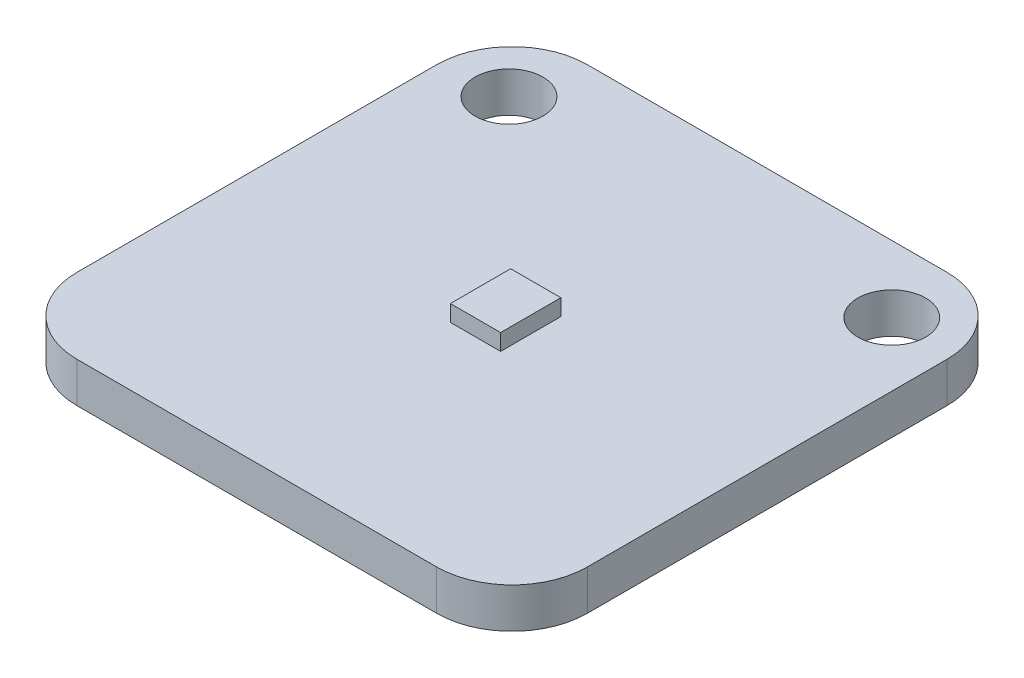
from build123d import *

# Parameters (mm, degrees)
FR4_DEPTH            = 1.6
SKETCH4_R            = 1.35
HOLES_MOUNTING_DEPTH = 15.45721965
SKETCH5_W            = 2
SKETCH5_H            = 2.4
TCS34725_DEPTH       = 0.65


with BuildPart() as part:
    # Sketch2 → FR4 (new body)
    with BuildSketch(Plane(origin=(0, 0, 0), x_dir=(1, 0, 0), z_dir=(0, 1, 0))):
        with BuildLine():
            Line((-7.16, 10.16), (7.16, 10.16))
            ThreePointArc((7.16, 10.16), (9.281320344, 9.281320344), (10.16, 7.16))
            Line((10.16, 7.16), (10.16, -7.16))
            ThreePointArc((10.16, -7.16), (9.281320344, -9.281320344), (7.16, -10.16))
            Line((7.16, -10.16), (-7.16, -10.16))
            ThreePointArc((-7.16, -10.16), (-9.281320344, -9.281320344), (-10.16, -7.16))
            Line((-10.16, -7.16), (-10.16, 7.16))
            ThreePointArc((-10.16, 7.16), (-9.281320344, 9.281320344), (-7.16, 10.16))
        make_face()
    extrude(amount=FR4_DEPTH)

    # Sketch4 → holes-mounting (cut, through all)
    with BuildSketch(Plane(origin=(0, 0, 0), x_dir=(1, 0, 0), z_dir=(0, 1, 0))):
        with Locations(Location((-7.62, 7.5, 0), (0, 0, 270))):
            Circle(SKETCH4_R)
        with Locations(Location((7.62, 7.5, 0), (0, 0, 90))):
            Circle(SKETCH4_R)
    extrude(amount=HOLES_MOUNTING_DEPTH, mode=Mode.SUBTRACT)


with BuildPart() as body_2:
    # Sketch5 → TCS34725 (new body)
    with BuildSketch(Plane(origin=(0, 1.6, 0), x_dir=(1, 0, 0), z_dir=(0, 1, 0))):
        with Locations((0, -0.254)):
            Rectangle(SKETCH5_W, SKETCH5_H)
    extrude(amount=TCS34725_DEPTH)


solid = Compound([part.part, body_2.part])
